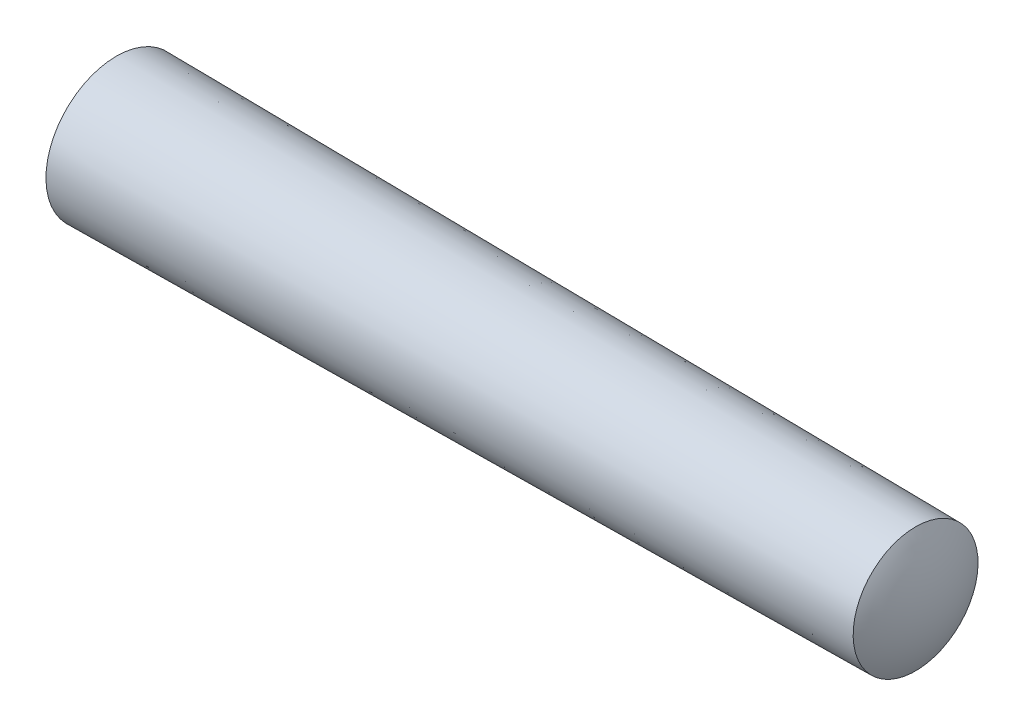
from build123d import *


with BuildPart() as part:
    # Skica1 → Otočit kolem osy1 (revolve)
    with BuildSketch(Plane.XY):
        with BuildLine():
            Line((0, 0.3384), (3.84, 0.3))
            ThreePointArc((3.84, 0.3), (3.899656551, 0.155241747), (3.92, 0))
            Line((3.92, 0), (3.84, 0))
            Line((3.84, 0), (0, 0))
            Line((0, 0), (-0.08, 0))
            ThreePointArc((-0.08, 0), (-0.059728106, 0.173863855), (0, 0.3384))
        make_face()
    revolve(axis=Axis((3.84, 0, 0), (-1, 0, 0)))


solid = part.part
